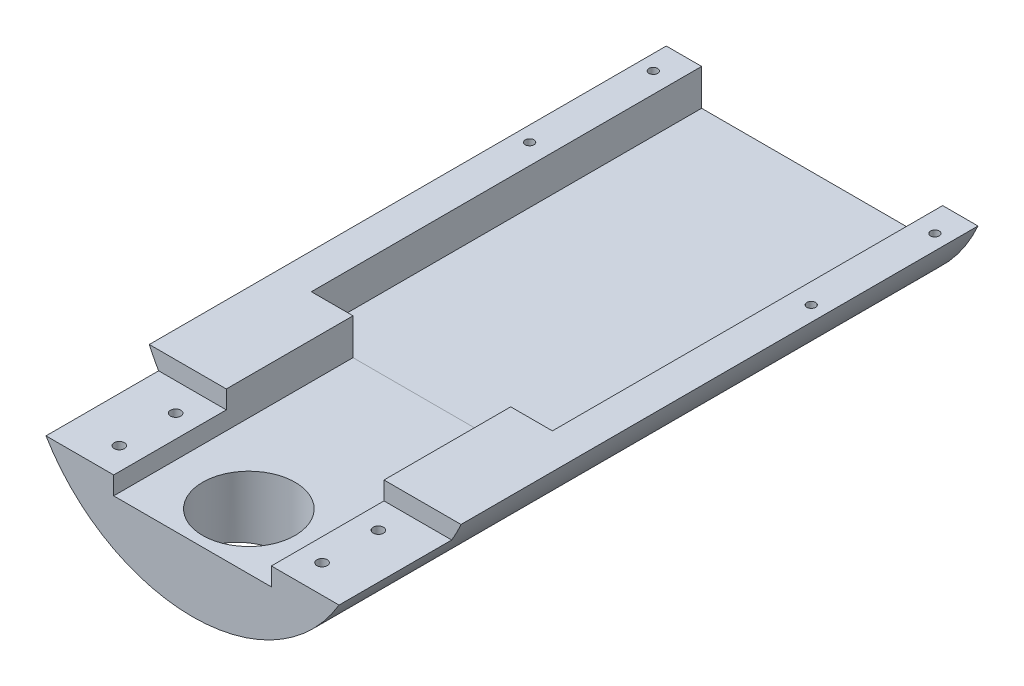
from build123d import *

# Parameters (mm, degrees)
BOSS_EXTRUDE1_START = 15
BOSS_EXTRUDE1_DEPTH = 279.5
SKETCH3_W           = 107
SKETCH3_H           = 93.25
CUT_EXTRUDE1_DEPTH  = 173.25
SKETCH4_R           = 20.5
CUT_EXTRUDE2_DEPTH  = 304.90560212
CUT_EXTRUDE3_START  = -50
CUT_EXTRUDE3_DEPTH  = 50
SKETCH7_R           = 2.3
CUT_EXTRUDE5_DEPTH  = 305.779129174
CUT_EXTRUDE8_START  = -304.43404156
SKETCH11_R          = 3.8
CUT_EXTRUDE8_DEPTH  = 311.43404156
SKETCH14_R          = 1.93
CUT_EXTRUDE9_DEPTH  = 7.25
SKETCH18_W          = 44.336356413
SKETCH18_H          = 6
CUT_EXTRUDE10_DEPTH = 125.5
CUT_EXTRUDE12_DEPTH = 100.5
SKETCH20_W          = 88.672712826
SKETCH20_H          = 6
BOSS_EXTRUDE2_DEPTH = 75.5
SCREW_HEAD_HOLE_R   = 3.3
SCREW_HEAD_HOLE_R_2 = 1.45
CUT_EXTRUDE13_DEPTH = 7


with BuildPart() as part:
    # Sketch1 → Boss-Extrude1 (new body)
    with BuildSketch(Plane.XY.offset(BOSS_EXTRUDE1_START)):
        with BuildLine():
            Line((-69.190786959, -30.525), (-35, -30.525))
            Line((-35, -30.525), (-35, -46.625))
            Line((-35, -46.625), (35, -46.625))
            Line((35, -46.625), (35, -30.525))
            Line((35, -30.525), (69.190786959, -30.525))
            ThreePointArc((69.190786959, -30.525), (0, -75.625), (-69.190786959, -30.525))
        make_face()
    extrude(amount=BOSS_EXTRUDE1_DEPTH)

    # Sketch3 → Cut-Extrude1 (cut)
    with BuildSketch(Plane(origin=(0, 0, 15), x_dir=(-1, 0, 0), z_dir=(0, 0, -1))):
        Rectangle(SKETCH3_W, SKETCH3_H)
    extrude(amount=-CUT_EXTRUDE1_DEPTH, mode=Mode.SUBTRACT)

    # Sketch4 → Cut-Extrude2 (cut, through all)
    with BuildSketch(Plane(origin=(0, -46.625, 0), x_dir=(1, 0, 0), z_dir=(0, 1, 0))):
        with Locations(Location((0, -269.5, 0), (0, 0, 270))):
            Circle(SKETCH4_R)
    extrude(amount=-CUT_EXTRUDE2_DEPTH, mode=Mode.SUBTRACT)

    # Sketch2 → Cut-Extrude3 (cut)
    with BuildSketch(Plane.XY.offset(294.5).offset(CUT_EXTRUDE3_START)):
        with BuildLine():
            Line((-35, -30.525), (-35, -38.575))
            Line((-35, -38.575), (-65.04698302, -38.575))
            ThreePointArc((-65.04698302, -38.575), (-67.239462723, -34.612068383), (-69.190786959, -30.525))
            Line((-69.190786959, -30.525), (-35, -30.525))
        make_face()
    cut_extrude3 = extrude(amount=CUT_EXTRUDE3_DEPTH, mode=Mode.SUBTRACT)

    # Mirror1: Cut-Extrude3 across plane
    add(cut_extrude3.mirror(Plane(origin=(0, 0, 0), x_dir=(0, 0, 1), z_dir=(1, 0, 0))), mode=Mode.SUBTRACT)

    # Sketch7 → Cut-Extrude5 (cut, through all)
    with BuildSketch(Plane(origin=(0, -38.575, 0), x_dir=(1, 0, 0), z_dir=(0, 1, 0))):
        with Locations(Location((45, -257, 0), (0, 0, 180))):
            Circle(SKETCH7_R)
        with Locations(Location((45, -282, 0), (0, 0, 180))):
            Circle(SKETCH7_R)
    cut_extrude5 = extrude(amount=-CUT_EXTRUDE5_DEPTH, mode=Mode.SUBTRACT)

    # Mirror2: Cut-Extrude5 across plane
    add(cut_extrude5.mirror(Plane(origin=(0, 0, 0), x_dir=(0, 0, 1), z_dir=(1, 0, 0))), mode=Mode.SUBTRACT)

    # Sketch11 → Cut-Extrude8 (cut)
    with BuildSketch(Plane(origin=(0, -52.075, 0), x_dir=(1, 0, 0), z_dir=(0, 1, 0)).offset(CUT_EXTRUDE8_START)):
        with Locations(Location((45, -282, 0), (0, 0, 180))):
            Circle(SKETCH11_R)
        with Locations(Location((45, -257, 0), (0, 0, 180))):
            Circle(SKETCH11_R)
    cut_extrude8 = extrude(amount=CUT_EXTRUDE8_DEPTH, mode=Mode.SUBTRACT)

    # Mirror3: Cut-Extrude8 across plane
    add(cut_extrude8.mirror(Plane(origin=(0, 0, 0), x_dir=(0, 0, 1), z_dir=(1, 0, 0))), mode=Mode.SUBTRACT)

    # Sketch14 → Cut-Extrude9 (cut)
    with BuildSketch(Plane(origin=(0, -30.525, 0), x_dir=(1, 0, 0), z_dir=(0, 1, 0))):
        with Locations(Location((62.5, -27.45, 0), (0, 0, 180))):
            Circle(SKETCH14_R)
        with Locations(Location((62.5, -82.35, 0), (0, 0, 180))):
            Circle(SKETCH14_R)
    cut_extrude9 = extrude(amount=-CUT_EXTRUDE9_DEPTH, mode=Mode.SUBTRACT)

    # Mirror4: Cut-Extrude9 across plane
    add(cut_extrude9.mirror(Plane(origin=(0, 0, 0), x_dir=(0, 0, 1), z_dir=(1, 0, 0))), mode=Mode.SUBTRACT)

    # Sketch18 → Cut-Extrude10 (cut)
    with BuildSketch(Plane(origin=(0, 0, 15), x_dir=(-1, 0, 0), z_dir=(0, 0, -1))):
        with Locations((-22.168178207, -53.125)):
            Rectangle(SKETCH18_W, SKETCH18_H)
        with Locations((22.168178207, -53.125)):
            Rectangle(SKETCH18_W, SKETCH18_H)
        with BuildLine():
            Line((42.207819181, -56.625), (0, -56.625))
            Line((0, -56.625), (0, -64.625))
            Line((0, -64.625), (28.486839066, -64.625))
            ThreePointArc((28.486839066, -64.625), (35.572934602, -61.011941035), (42.207819181, -56.625))
        make_face()
        with BuildLine():
            Line((0, -64.625), (0, -56.625))
            Line((0, -56.625), (-42.207819181, -56.625))
            ThreePointArc((-42.207819181, -56.625), (-35.572934602, -61.011941035), (-28.486839066, -64.625))
            Line((-28.486839066, -64.625), (0, -64.625))
        make_face()
        with BuildLine():
            Line((42.207819181, -56.625), (0, -56.625))
            Line((0, -56.625), (0, -64.625))
            Line((0, -64.625), (28.486839066, -64.625))
            ThreePointArc((28.486839066, -64.625), (35.572934602, -61.011941035), (42.207819181, -56.625))
        make_face()
        with BuildLine():
            Line((0, -64.625), (0, -56.625))
            Line((0, -56.625), (-42.207819181, -56.625))
            ThreePointArc((-42.207819181, -56.625), (-35.572934602, -61.011941035), (-28.486839066, -64.625))
            Line((-28.486839066, -64.625), (0, -64.625))
        make_face()
        with BuildLine():
            Line((-42.207819181, -56.625), (0, -56.625))
            Line((0, -56.625), (0, -56.125))
            Line((0, -56.125), (-44.336356413, -56.125))
            ThreePointArc((-44.336356413, -56.125), (-37.468701056, -60.779511824), (-30.117416058, -64.625))
            Line((-30.117416058, -64.625), (-28.486839066, -64.625))
            ThreePointArc((-28.486839066, -64.625), (-35.572934602, -61.011941035), (-42.207819181, -56.625))
        make_face()
        with BuildLine():
            Line((0, -56.125), (0, -56.625))
            Line((0, -56.625), (42.207819181, -56.625))
            ThreePointArc((42.207819181, -56.625), (35.572934602, -61.011941035), (28.486839066, -64.625))
            Line((28.486839066, -64.625), (30.117416058, -64.625))
            ThreePointArc((30.117416058, -64.625), (37.468701056, -60.779511824), (44.336356413, -56.125))
            Line((44.336356413, -56.125), (0, -56.125))
        make_face()
        with BuildLine():
            Line((-42.207819181, -56.625), (0, -56.625))
            Line((0, -56.625), (0, -56.125))
            Line((0, -56.125), (-44.336356413, -56.125))
            ThreePointArc((-44.336356413, -56.125), (-37.468701056, -60.779511824), (-30.117416058, -64.625))
            Line((-30.117416058, -64.625), (-28.486839066, -64.625))
            ThreePointArc((-28.486839066, -64.625), (-35.572934602, -61.011941035), (-42.207819181, -56.625))
        make_face()
        with BuildLine():
            Line((0, -56.125), (0, -56.625))
            Line((0, -56.625), (42.207819181, -56.625))
            ThreePointArc((42.207819181, -56.625), (35.572934602, -61.011941035), (28.486839066, -64.625))
            Line((28.486839066, -64.625), (30.117416058, -64.625))
            ThreePointArc((30.117416058, -64.625), (37.468701056, -60.779511824), (44.336356413, -56.125))
            Line((44.336356413, -56.125), (0, -56.125))
        make_face()
    extrude(amount=-CUT_EXTRUDE10_DEPTH, mode=Mode.SUBTRACT)

    # Sketch19 → Cut-Extrude12 (cut)
    with BuildSketch(Plane(origin=(0, 0, 40), x_dir=(-1, 0, 0), z_dir=(0, 0, -1))):
        with BuildLine():
            ThreePointArc((-30.117416058, -64.625), (0, -71.125), (30.117416058, -64.625))
            Line((30.117416058, -64.625), (-30.117416058, -64.625))
        make_face()
    extrude(amount=-CUT_EXTRUDE12_DEPTH, mode=Mode.SUBTRACT)

    # Sketch20 → Boss-Extrude2 (add)
    with BuildSketch(Plane(origin=(0, 0, 65), x_dir=(-1, 0, 0), z_dir=(0, 0, -1))):
        with Locations((0, -53.125)):
            Rectangle(SKETCH20_W, SKETCH20_H)
    extrude(amount=-BOSS_EXTRUDE2_DEPTH)

    # screw head hole → Cut-Extrude13 (cut)
    # profile 1 of 2: a face of its own
    with BuildSketch(Plane(origin=(0, 0, 15), x_dir=(-1, 0, 0), z_dir=(0, 0, -1))):
        with Locations((0, -68.825)):
            Circle(SCREW_HEAD_HOLE_R)
        with Locations((0, -68.825)):
            Circle(SCREW_HEAD_HOLE_R_2, mode=Mode.SUBTRACT)
    # profile 2 of 2: a face of its own
    with BuildSketch(Plane(origin=(0, 0, 15), x_dir=(-1, 0, 0), z_dir=(0, 0, -1))):
        with Locations((0, -68.825)):
            Circle(SCREW_HEAD_HOLE_R_2)
    extrude(amount=-CUT_EXTRUDE13_DEPTH, mode=Mode.SUBTRACT)


solid = part.part
